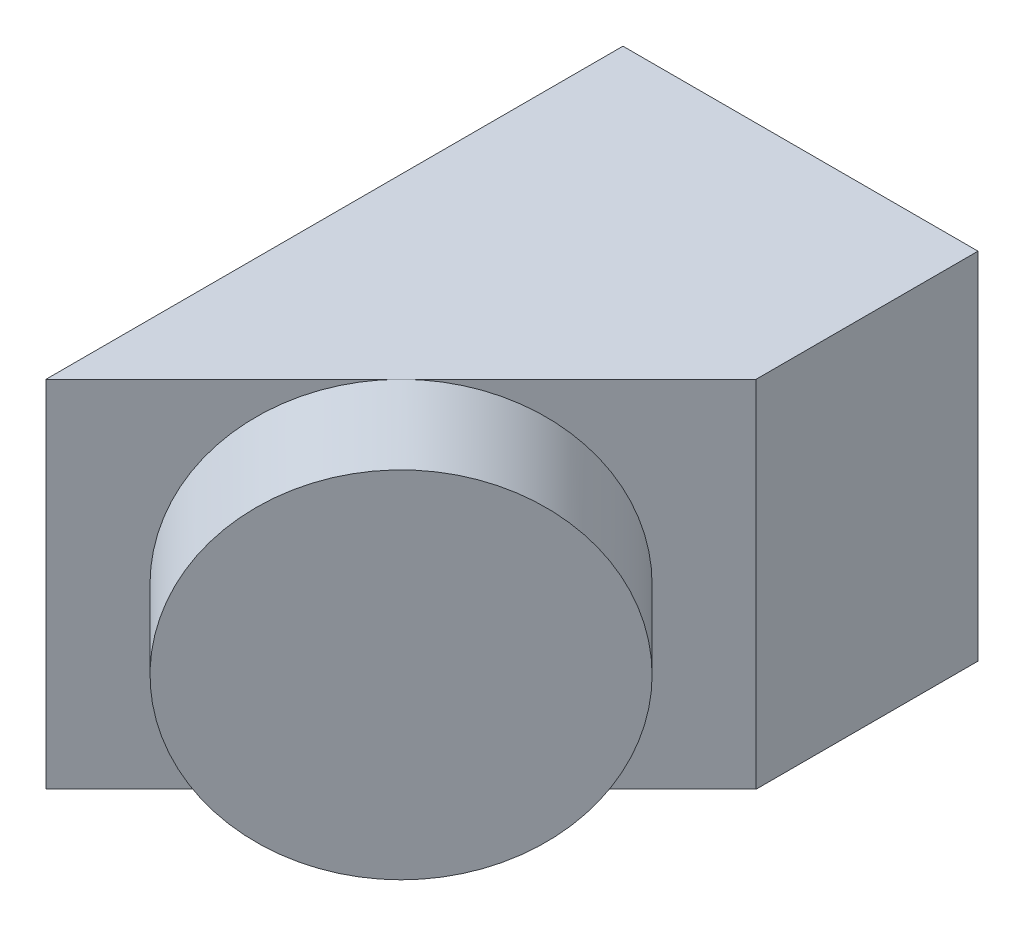
from build123d import *

# Parameters (mm, degrees)
SKETCH_1_W      = 16
SKETCH_1_H      = 16
SKETCH_1_W_2    = 10
SKETCH_1_H_2    = 10
EXTRUDE_1_DEPTH = 10
EXTRUDE_2_DEPTH = 16
EXTRUDE_3_DEPTH = 5


with BuildPart() as part:
    # 草图1 → 凸台-拉伸1 (new body)
    with BuildSketch(Plane.XY):
        with Locations((8, 8)):
            Rectangle(SKETCH_1_W, SKETCH_1_H)
        with Locations((8, 8)):
            Rectangle(SKETCH_1_W_2, SKETCH_1_H_2, mode=Mode.SUBTRACT)
    extrude(amount=EXTRUDE_1_DEPTH)

    # 草图2 → 凸台-拉伸2 (add)
    with BuildSketch(Plane.XZ):
        Polygon((0, 10), (0, 26), (16, 10), align=None)
    extrude(amount=-EXTRUDE_2_DEPTH)

    # 草图6 → 凸台-拉伸3 (add)
    with BuildSketch(Plane(origin=(13, 0, 13), x_dir=(0.7071067811865475, 0, -0.7071067811865477), z_dir=(0.7071067811865477, 0, 0.7071067811865475))):
        with BuildLine():
            ThreePointArc((-7.071067812, 16), (-15.071067812, 8), (-7.071067812, 0))
            Line((-7.071067812, 0), (-7.071067812, 16))
        make_face()
        with BuildLine():
            Line((-7.071067812, 16), (-7.071067812, 0))
            ThreePointArc((-7.071067812, 0), (-1.414213562, 2.343145751), (0.928932188, 8))
            ThreePointArc((0.928932188, 8), (-1.414213562, 13.656854249), (-7.071067812, 16))
        make_face()
    extrude(amount=EXTRUDE_3_DEPTH)


solid = part.part
